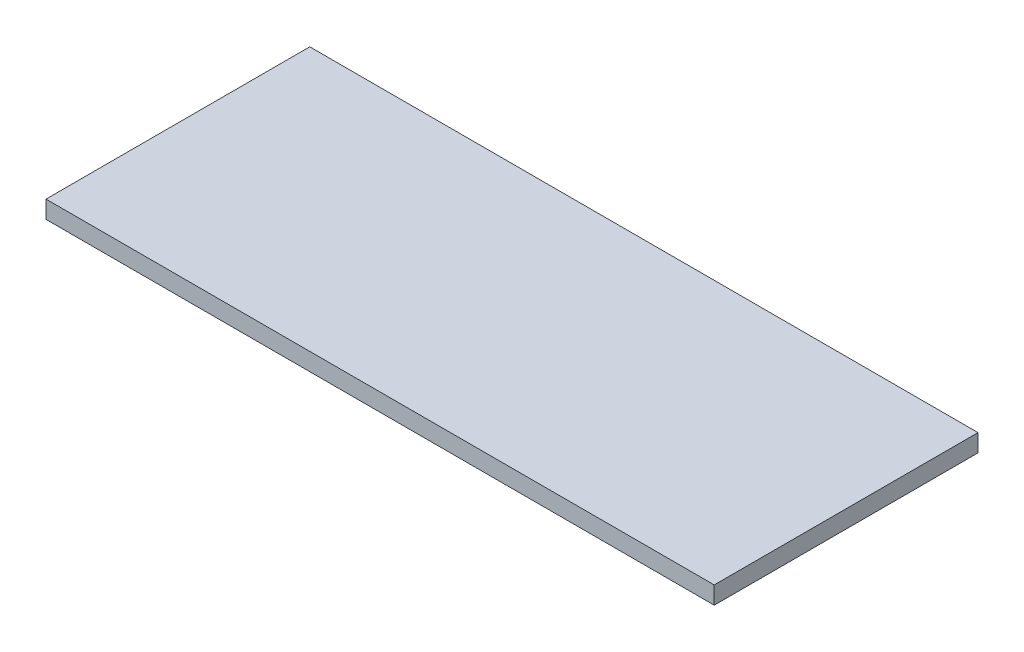
from build123d import *

# Parameters (mm, degrees)
SKETCH1_W           = 380
SKETCH1_H           = 150
BOSS_EXTRUDE1_DEPTH = 10


with BuildPart() as part:
    # Sketch1 → Boss-Extrude1 (new body)
    with BuildSketch(Plane(origin=(0, 0, 0), x_dir=(1, 0, 0), z_dir=(0, 1, 0))):
        Rectangle(SKETCH1_W, SKETCH1_H)
    extrude(amount=BOSS_EXTRUDE1_DEPTH)


solid = part.part
